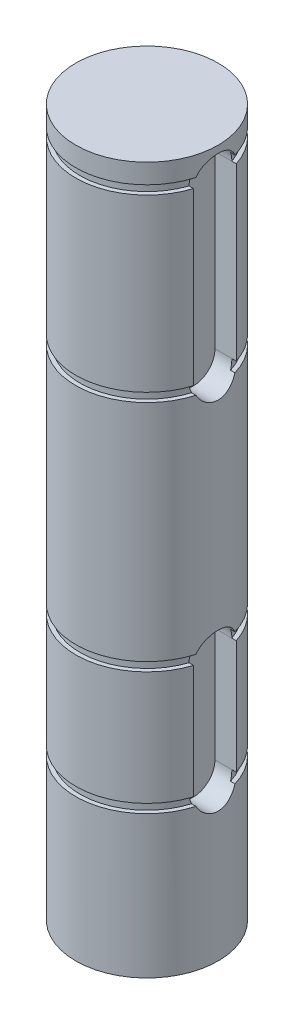
from build123d import *

# Parameters (mm, degrees)
SKETCH1_R           = 3.125
BOSS_EXTRUDE1_DEPTH = 31.02
SKETCH2_W           = 3.905114493
SKETCH2_H           = 0.39
SKETCH3_W           = 3.758921356
SKETCH3_H           = 0.39
SKETCH4_W           = 9.324870886
SKETCH4_H           = 0.39
SKETCH5_W           = 5.319059986
SKETCH5_H           = 0.39
CUT_EXTRUDE1_DEPTH  = 1.08
CUT_EXTRUDE2_DEPTH  = 1.08


with BuildPart() as part:
    # Sketch1 → Boss-Extrude1 (new body)
    with BuildSketch(Plane(origin=(0, 0, 0), x_dir=(1, 0, 0), z_dir=(0, 1, 0))):
        with Locations(Location((0, 0, 0), (0, 0, 270))):
            Circle(SKETCH1_R)
    extrude(amount=BOSS_EXTRUDE1_DEPTH)

    # Sketch2 → Cut-Revolve1 (revolve, cut)
    with BuildSketch(Plane(origin=(0, 0, 0), x_dir=(0, 0, -1), z_dir=(1, 0, 0))):
        with Locations((-4.892557247, 6.445)):
            Rectangle(SKETCH2_W, SKETCH2_H)
    revolve(axis=Axis((0, 10.072914163, 0), (0, -1, 0)), mode=Mode.SUBTRACT)

    # Sketch3 → Cut-Revolve2 (revolve, cut)
    with BuildSketch(Plane(origin=(0, 0, 0), x_dir=(0, 0, -1), z_dir=(1, 0, 0)), mode=Mode.PRIVATE) as cut_revolve2_sk:
        with Locations((-4.819460678, 11.835)):
            Rectangle(SKETCH3_W, SKETCH3_H)
    revolve(cut_revolve2_sk.sketch.rotate(Axis((0, 13.686668931, 0), (0, -1, 0)), 180), axis=Axis((0, 13.686668931, 0), (0, -1, 0)), mode=Mode.SUBTRACT)

    # Sketch4 → Cut-Revolve3 (revolve, cut)
    with BuildSketch(Plane(origin=(0, 0, 0), x_dir=(0, 0, -1), z_dir=(1, 0, 0)), mode=Mode.PRIVATE) as cut_revolve3_sk:
        with Locations((-7.602435443, 22.075)):
            Rectangle(SKETCH4_W, SKETCH4_H)
    revolve(cut_revolve3_sk.sketch.rotate(Axis((0, 25.014989783, 0), (0, -1, 0)), 180), axis=Axis((0, 25.014989783, 0), (0, -1, 0)), mode=Mode.SUBTRACT)

    # Sketch5 → Cut-Revolve4 (revolve, cut)
    with BuildSketch(Plane(origin=(0, 0, 0), x_dir=(0, 0, -1), z_dir=(1, 0, 0)), mode=Mode.PRIVATE) as cut_revolve4_sk:
        with Locations((-5.599529993, 29.965)):
            Rectangle(SKETCH5_W, SKETCH5_H)
    revolve(cut_revolve4_sk.sketch.rotate(Axis((0, 30.713823838, 0), (0, -1, 0)), 180), axis=Axis((0, 30.713823838, 0), (0, -1, 0)), mode=Mode.SUBTRACT)

    # Sketch6 → Cut-Extrude1 (cut)
    with BuildSketch(Plane(origin=(3.125, 0, 0), x_dir=(0, 0, -1), z_dir=(1, 0, 0))):
        with BuildLine():
            Line((0.94, 29.77), (0.94, 22.27))
            ThreePointArc((0.94, 22.27), (0, 21.33), (-0.94, 22.27))
            Line((-0.94, 22.27), (-0.94, 29.77))
            ThreePointArc((-0.94, 29.77), (0, 30.71), (0.94, 29.77))
        make_face()
    extrude(amount=-CUT_EXTRUDE1_DEPTH, mode=Mode.SUBTRACT)

    # Sketch7 → Cut-Extrude2 (cut)
    with BuildSketch(Plane(origin=(3.125, 0, 0), x_dir=(0, 0, -1), z_dir=(1, 0, 0))):
        with BuildLine():
            Line((0.94, 11.64), (0.94, 6.64))
            ThreePointArc((0.94, 6.64), (0, 5.7), (-0.94, 6.64))
            Line((-0.94, 6.64), (-0.94, 11.64))
            ThreePointArc((-0.94, 11.64), (0, 12.58), (0.94, 11.64))
        make_face()
    extrude(amount=-CUT_EXTRUDE2_DEPTH, mode=Mode.SUBTRACT)


solid = part.part
